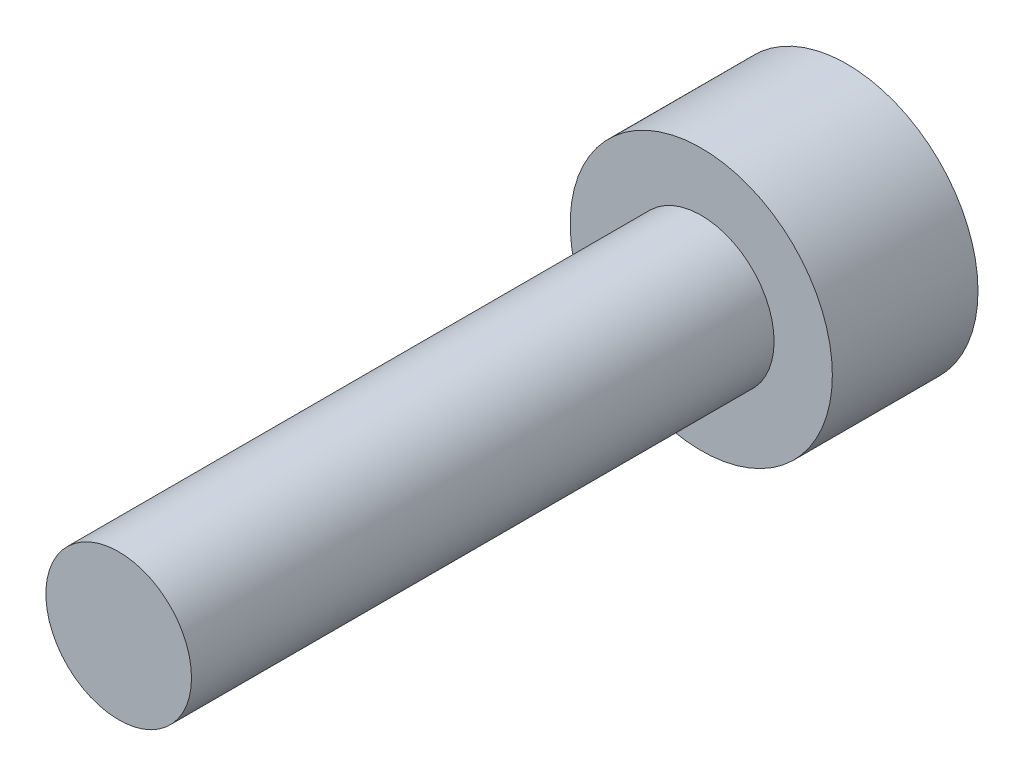
from build123d import *

# Parameters (mm, degrees)
SKETCH_1_R          = 2.25
EXTRUDE_1_DEPTH     = 2.5
SKETCH_2_R          = 1.25
EXTRUDE_2_DEPTH     = 10
CUT_EXTRUDE_1_DEPTH = 1


with BuildPart() as part:
    # 草图1 → 凸台-拉伸1 (new body)
    with BuildSketch(Plane.XY):
        Circle(SKETCH_1_R)
    extrude(amount=EXTRUDE_1_DEPTH)

    # 草图2 → 凸台-拉伸2 (add)
    with BuildSketch(Plane.XY.offset(2.5)):
        Circle(SKETCH_2_R)
    extrude(amount=EXTRUDE_2_DEPTH)

    # 草图3 → 切除-拉伸1 (cut)
    with BuildSketch(Plane(origin=(0, 0, 0), x_dir=(-1, 0, 0), z_dir=(0, 0, -1))):
        Polygon((1.154700538, 0), (0.577350269, 1), (-0.577350269, 1), (-1.154700538, 0), (-0.577350269, -1), (0.577350269, -1), align=None)
    extrude(amount=-CUT_EXTRUDE_1_DEPTH, mode=Mode.SUBTRACT)


solid = part.part
